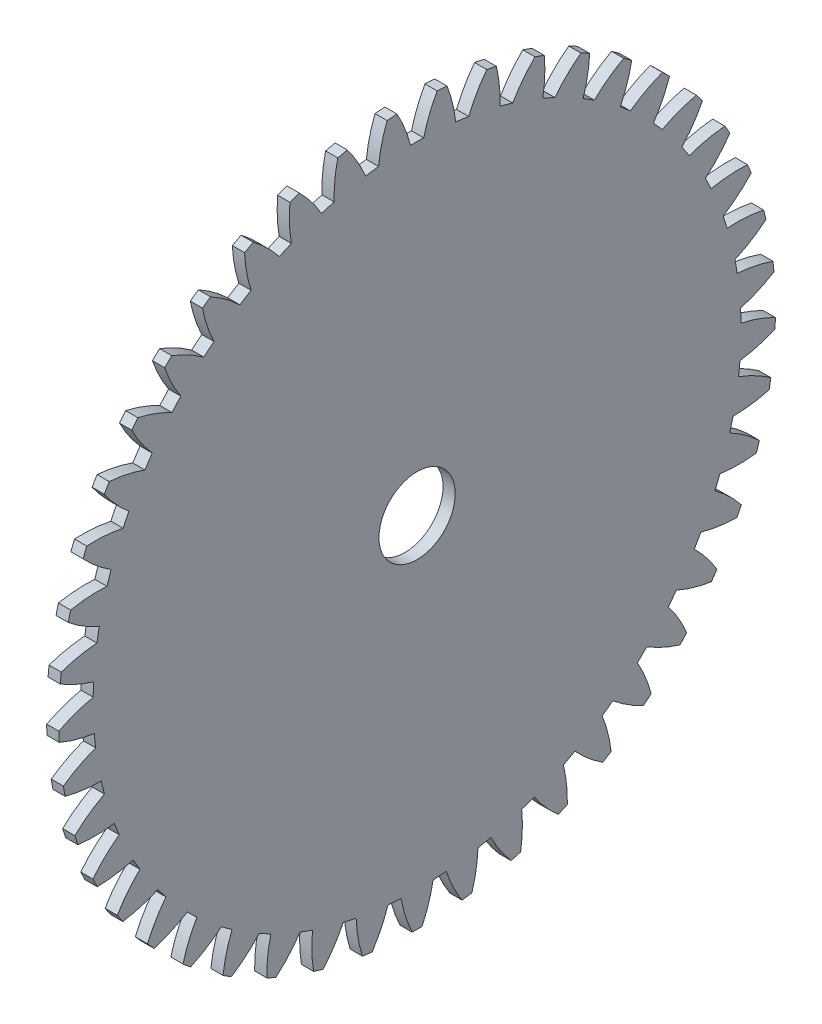
from build123d import *

# Parameters (mm, degrees)
BASPROSKE_W     = 0.2
BASPROSKE_H     = 5.875
TOOTHCUT_DEPTH  = 9.310911502
TEETHCUTS_COUNT = 45
TEETHCUTS_ANGLE = 352
BORSKE_R        = 0.625
BORE_DEPTH      = 50.0000508


with BuildPart() as part:
    # BasProSke → Base-Revolve (revolve)
    with BuildSketch(Plane(origin=(0, 0, 0), x_dir=(1, 0, 0), z_dir=(0, 1, 0)), mode=Mode.PRIVATE) as base_revolve_sk:
        with Locations((0.1, 2.9375)):
            Rectangle(BASPROSKE_W, BASPROSKE_H)
    revolve(base_revolve_sk.sketch.rotate(Axis((-10, 0, 0), (1, 0, 0)), 180), axis=Axis((-10, 0, 0), (1, 0, 0)))

    # TooCutSke → ToothCut (cut, through all)
    with BuildSketch(Plane(origin=(0, 0, 0), x_dir=(0, 0, -1), z_dir=(1, 0, 0))):
        with BuildLine():
            ThreePointArc((0.107981499, 5.310402268), (0, 5.3115), (-0.107981499, 5.310402268))
            ThreePointArc((-0.107981499, 5.310402268), (-0.205223064, 5.608623092), (-0.342993747, 5.890422349))
            ThreePointArc((-0.342993747, 5.890422349), (0, 5.9004), (0.342993747, 5.890422349))
            ThreePointArc((0.342993747, 5.890422349), (0.205223064, 5.608623092), (0.107981499, 5.310402268))
        make_face()
    toothcut = extrude(amount=TOOTHCUT_DEPTH, mode=Mode.SUBTRACT)

    # TeethCuts: ToothCut ×45 about axis
    teethcuts_axis = Axis((-10, 0, 0), (1, 0, 0))
    for i in range(1, TEETHCUTS_COUNT):
        add(toothcut.rotate(teethcuts_axis, i * TEETHCUTS_ANGLE / (TEETHCUTS_COUNT - 1)), mode=Mode.SUBTRACT)

    # BorSke → Bore (cut, symmetric)
    with BuildSketch(Plane(origin=(0, 0, 0), x_dir=(0, 0, -1), z_dir=(1, 0, 0))):
        with Locations(Location((0, 0, 0), (0, 0, 180))):
            Circle(BORSKE_R)
    extrude(amount=BORE_DEPTH, both=True, mode=Mode.SUBTRACT)


solid = part.part
